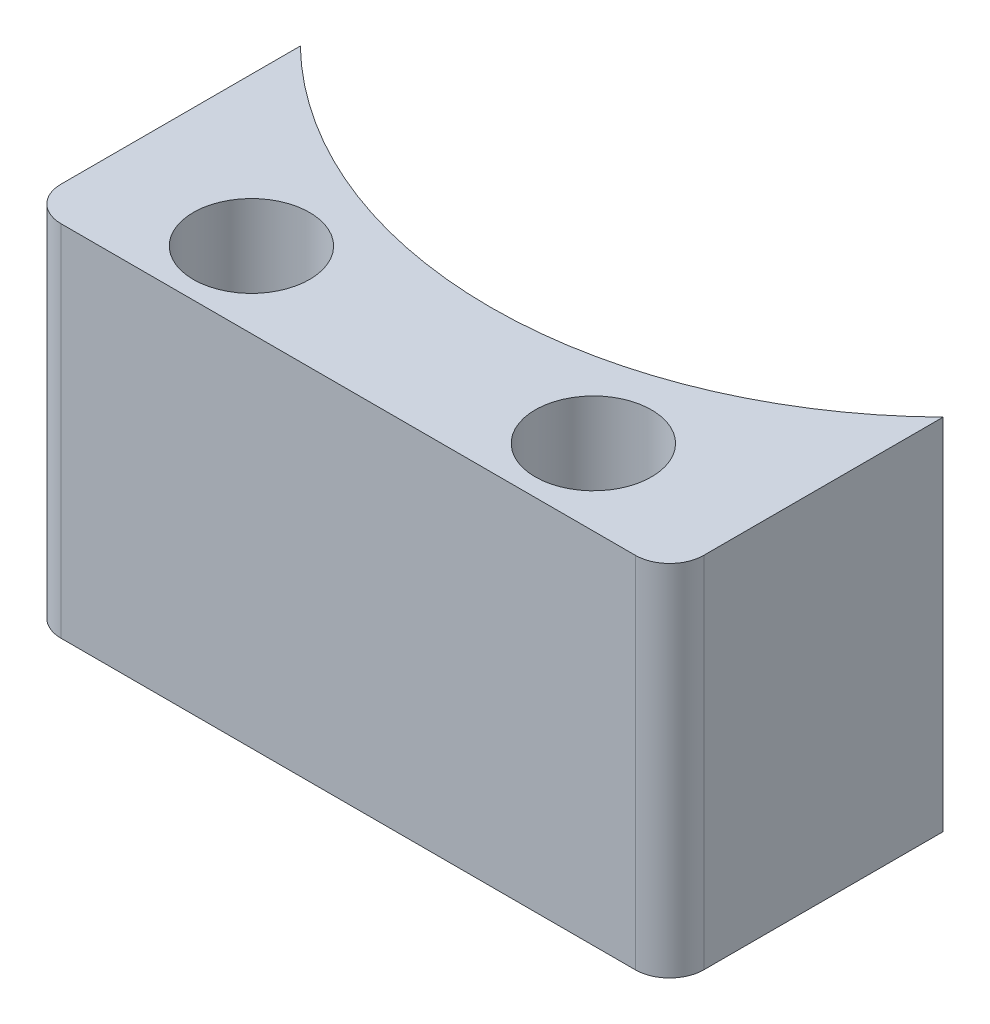
from build123d import *

# Parameters (mm, degrees)
EXTRUDE_1_DEPTH   = 10.5
FILLET_1_R        = 1
HOLE_WIZARD_M31_D = 3.4


with BuildPart() as part:
    # Эскиз1 → Бобышка-Вытянуть1 (new body)
    with BuildSketch(Plane(origin=(0, 0, 0), x_dir=(1, 0, 0), z_dir=(0, 1, 0))):
        with BuildLine():
            Line((0, 0), (0, -8))
            Line((0, -8), (18.8, -8))
            Line((18.8, -8), (18.8, 0))
            ThreePointArc((18.8, 0), (9.4, -3.835773145), (0, 0))
        make_face()
    extrude(amount=EXTRUDE_1_DEPTH)

    # Скругление1
    fillet_1_edges = [part.edges().sort_by_distance(p)[0] for p in [
        (18.8, 5.25, 8),
        (0, 5.25, 8),
    ]]
    fillet(fillet_1_edges, radius=FILLET_1_R)

    # Отверстие с зазором M31 (through all)
    with Locations(Plane(origin=(0, 10.5, 0), x_dir=(1, 0, 0), z_dir=(0, 1, 0))):
        with Locations((4.350247301, -5.779226371), (14.350247301, -5.779226371)):
            Hole(HOLE_WIZARD_M31_D / 2)


solid = part.part
